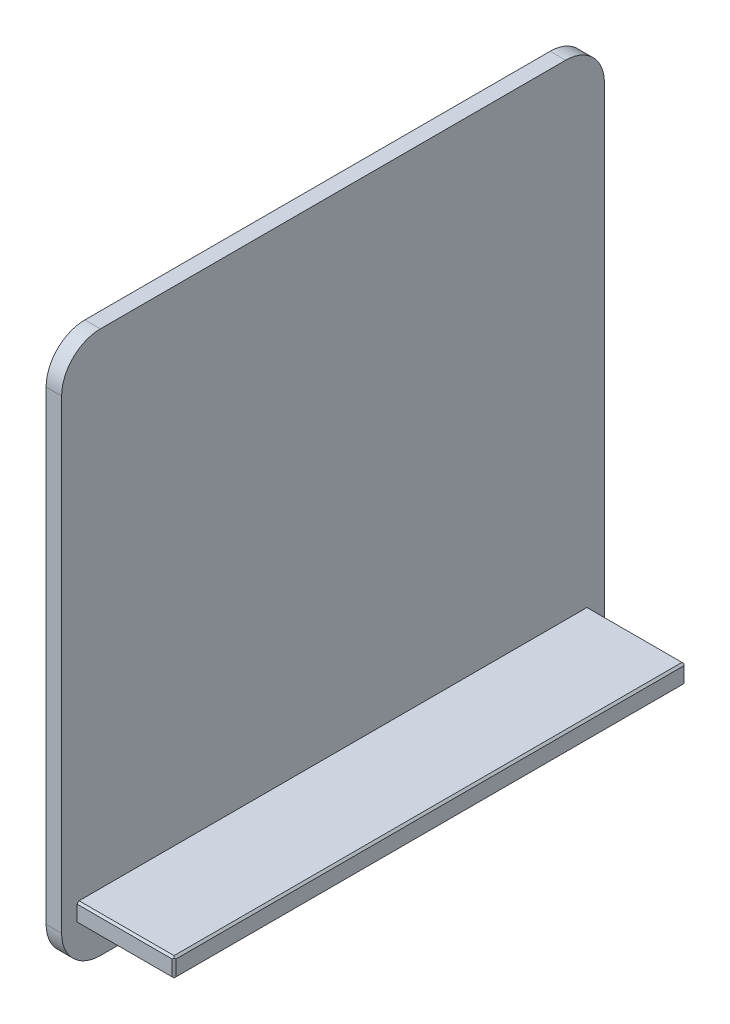
from build123d import *

# Parameters (mm, degrees)
SKETCH_1_W      = 140
SKETCH_1_H      = 140
EXTRUDE_1_DEPTH = 4
SKETCH_3_W      = 132
SKETCH_3_H      = 5
EXTRUDE_2_DEPTH = 25
CHAMFER_1_SIZE  = 0.5
CHAMFER_2_SIZE  = 0.5
FILLET_1_R      = 10


with BuildPart() as part:
    # 草图1 → 凸台-拉伸1 (new body)
    with BuildSketch(Plane(origin=(0, 0, 0), x_dir=(0, 0, -1), z_dir=(1, 0, 0))):
        Rectangle(SKETCH_1_W, SKETCH_1_H)
    extrude(amount=EXTRUDE_1_DEPTH)

    # 草图3 → 凸台-拉伸2 (add)
    with BuildSketch(Plane(origin=(4, 0, 0), x_dir=(0, 0, -1), z_dir=(1, 0, 0))):
        with Locations((0, -57.5)):
            Rectangle(SKETCH_3_W, SKETCH_3_H)
    extrude(amount=EXTRUDE_2_DEPTH)

    # 倒角1
    chamfer_1_edges = [part.edges().sort_by_distance(p)[0] for p in [
        (29, -57.5, 66),
        (29, -60, 0),
        (29, -57.5, -66),
        (29, -55, 0),
    ]]
    chamfer(chamfer_1_edges, length=CHAMFER_1_SIZE)

    # 倒角2
    chamfer_2_edges = [part.edges().sort_by_distance(p)[0] for p in [
        (16.25, -55, 66),
        (16.25, -55, -66),
        (16.25, -60, -66),
        (16.25, -60, 66),
    ]]
    chamfer(chamfer_2_edges, length=CHAMFER_2_SIZE)

    # 圆角1
    fillet_1_edges = [part.edges().sort_by_distance(p)[0] for p in [
        (2, 70, 70),
        (2, 70, -70),
        (2, -70, -70),
        (2, -70, 70),
    ]]
    fillet(fillet_1_edges, radius=FILLET_1_R)


solid = part.part
